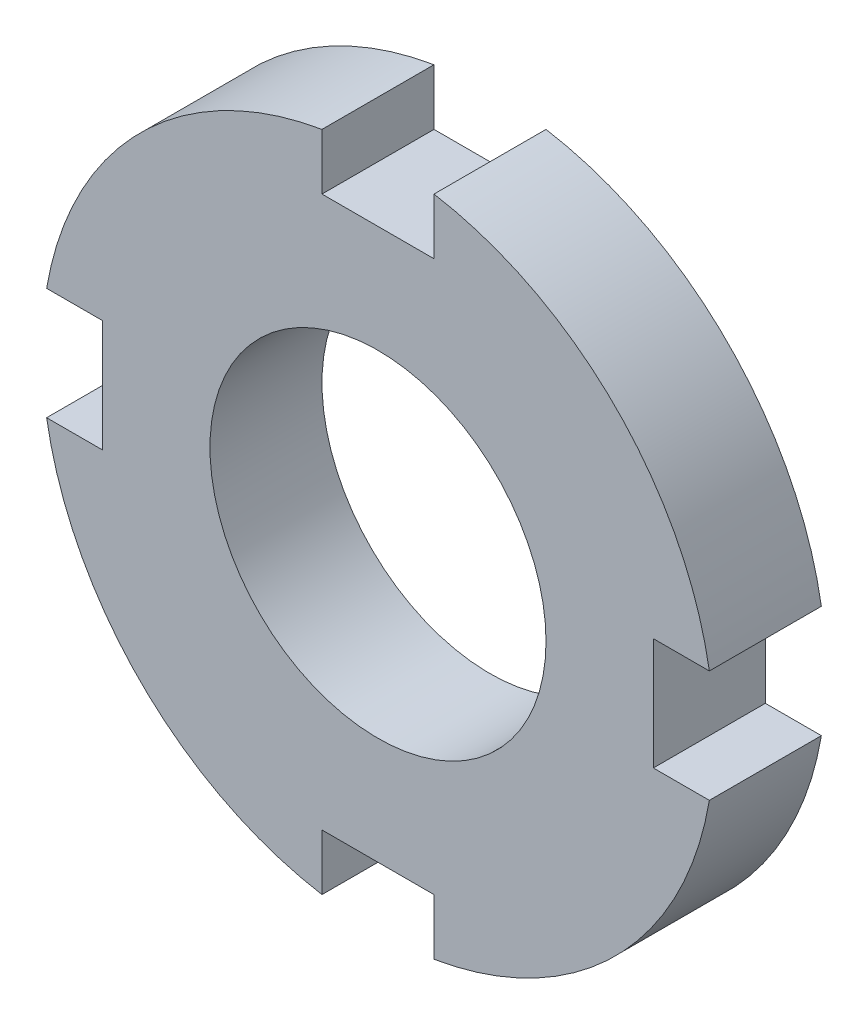
from build123d import *

# Parameters (mm, degrees)
SKETCH_1_R      = 6
EXTRUDE_1_DEPTH = 4


with BuildPart() as part:
    # 草图1 → 拉伸1 (new body)
    with BuildSketch(Plane.XY):
        with BuildLine():
            Line((9.832159566, 2), (11.832159566, 2))
            ThreePointArc((11.832159566, 2), (8.485281374, 8.485281374), (2, 11.832159566))
            Line((2, 11.832159566), (2, 9.832159566))
            Line((2, 9.832159566), (-2, 9.832159566))
            Line((-2, 9.832159566), (-2, 11.832159566))
            ThreePointArc((-2, 11.832159566), (-8.485281374, 8.485281374), (-11.832159566, 2))
            Line((-11.832159566, 2), (-9.832159566, 2))
            Line((-9.832159566, 2), (-9.832159566, -2))
            Line((-9.832159566, -2), (-11.832159566, -2))
            ThreePointArc((-11.832159566, -2), (-8.485281374, -8.485281374), (-2, -11.832159566))
            Line((-2, -11.832159566), (-2, -9.832159566))
            Line((-2, -9.832159566), (2, -9.832159566))
            Line((2, -9.832159566), (2, -11.832159566))
            ThreePointArc((2, -11.832159566), (8.485281374, -8.485281374), (11.832159566, -2))
            Line((11.832159566, -2), (9.832159566, -2))
            Line((9.832159566, -2), (9.832159566, 2))
        make_face()
        Circle(SKETCH_1_R, mode=Mode.SUBTRACT)
    extrude(amount=EXTRUDE_1_DEPTH)


solid = part.part
